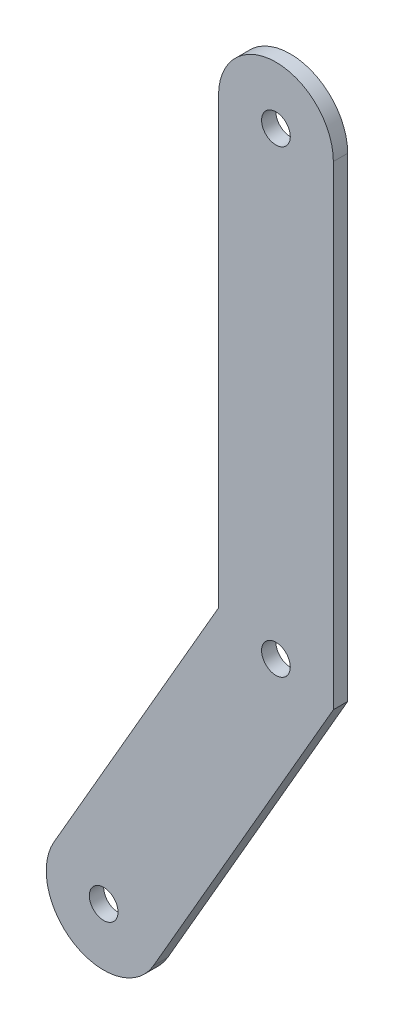
from build123d import *

# Parameters (mm, degrees)
SKETCH1_R           = 12.7
BOSS_EXTRUDE1_DEPTH = 12.7


with BuildPart() as part:
    # Sketch1 → Boss-Extrude1 (new body)
    with BuildSketch(Plane.XY):
        with BuildLine():
            Line((-108.405909488, -695.764543073), (50.8, -420.011818976))
            Line((50.8, -420.011818976), (50.8, 0))
            ThreePointArc((50.8, 0), (0, 50.8), (-50.8, 0))
            Line((-50.8, 0), (-50.8, -392.788181024))
            Line((-50.8, -392.788181024), (-196.394090512, -644.964543073))
            ThreePointArc((-196.394090512, -644.964543073), (-177.8, -714.358633586), (-108.405909488, -695.764543073))
        make_face()
        Circle(SKETCH1_R, mode=Mode.SUBTRACT)
        with Locations((-152.4, -670.364543073)):
            Circle(SKETCH1_R, mode=Mode.SUBTRACT)
        with Locations((0, -406.4)):
            Circle(SKETCH1_R, mode=Mode.SUBTRACT)
    extrude(amount=BOSS_EXTRUDE1_DEPTH)


solid = part.part
